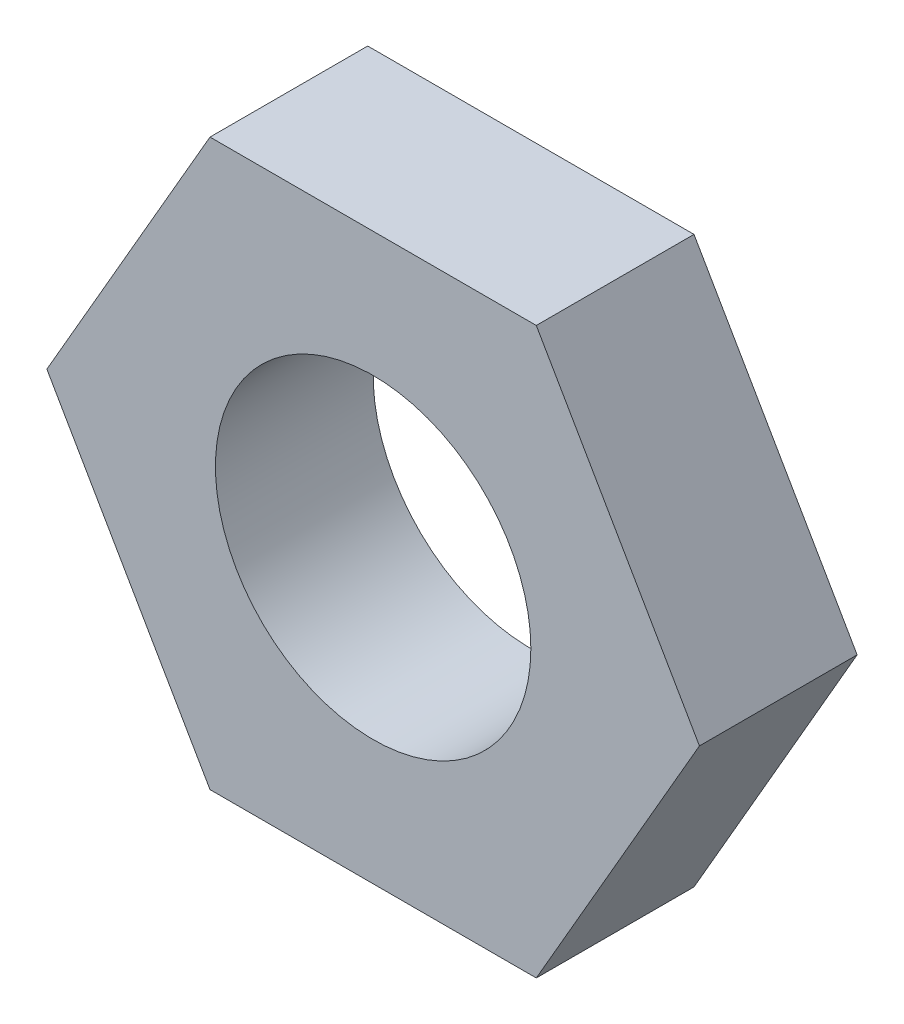
from build123d import *

# Parameters (mm, degrees)
ESQUISSE1_R        = 3
BOSS_EXTRU_1_DEPTH = 3


with BuildPart() as part:
    # Esquisse1 → Boss.-Extru.1 (new body)
    with BuildSketch(Plane.XY):
        Polygon((6.206515394, 0), (3.103257697, 5.375), (-3.103257697, 5.375), (-6.206515394, 0), (-3.103257697, -5.375), (3.103257697, -5.375), align=None)
        Circle(ESQUISSE1_R, mode=Mode.SUBTRACT)
    extrude(amount=BOSS_EXTRU_1_DEPTH)


solid = part.part
